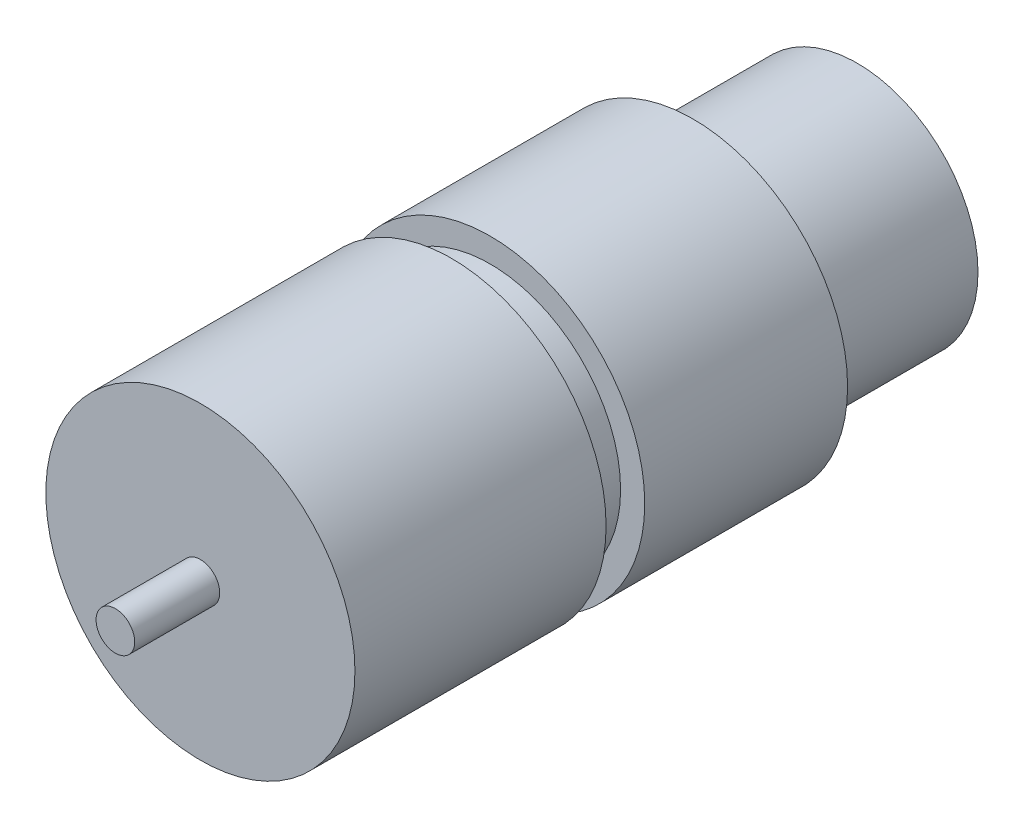
from build123d import *

# Parameters (mm, degrees)
SKETCH_1_R          = 12.5
EXTRUDE_1_DEPTH     = 17
SKETCH_2_R          = 16
EXTRUDE_2_DEPTH     = 51
SKETCH_3_R          = 2
EXTRUDE_3_DEPTH     = 8.8
SKETCH_7_R          = 20.782497367
SKETCH_7_R_2        = 13.5
CUT_EXTRUDE_8_DEPTH = 4


with BuildPart() as part:
    # Эскиз1 → Вытянуть1 (new body)
    with BuildSketch(Plane.XY):
        Circle(SKETCH_1_R)
    extrude(amount=EXTRUDE_1_DEPTH)

    # Эскиз2 → Вытянуть2 (add)
    with BuildSketch(Plane.XY.offset(17)):
        Circle(SKETCH_2_R)
    extrude(amount=EXTRUDE_2_DEPTH)

    # Эскиз3 → Вытянуть3 (add)
    with BuildSketch(Plane.XY.offset(68)):
        Circle(SKETCH_3_R)
    extrude(amount=EXTRUDE_3_DEPTH)

    # Эскиз7 → Вытянуть8 (cut)
    with BuildSketch(Plane.XY.offset(38)):
        Circle(SKETCH_7_R)
        Circle(SKETCH_7_R_2, mode=Mode.SUBTRACT)
    extrude(amount=CUT_EXTRUDE_8_DEPTH, mode=Mode.SUBTRACT)


solid = part.part
